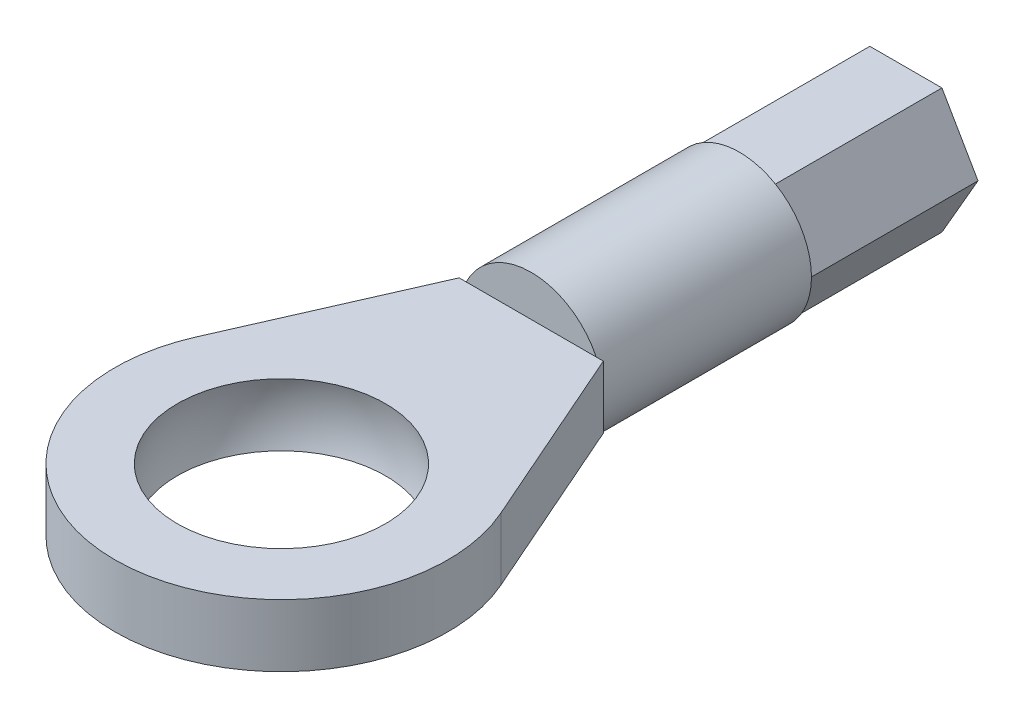
from build123d import *

# Parameters (mm, degrees)
SKETCH_1_R           = 1
EXTRUDE_1_DEPTH      = 4
EXTRUDE_START        = 4
SKETCH_2_R           = 1.732050808
EXTRUDE_2_DEPTH      = 5
EXTRUDE_3_DEPTH      = 0.75
EXTRUDE_3_DEPTH_BACK = 0.75
SKETCH_3_R           = 2.5


with BuildPart() as part:
    # 草图1 → 凸台-拉伸1 (new body)
    with BuildSketch(Plane.XY):
        Polygon((0.866025404, 1.5), (-0.866025404, 1.5), (-1.732050808, 0), (-0.866025404, -1.5), (0.866025404, -1.5), (1.732050808, 0), align=None)
        Circle(SKETCH_1_R, mode=Mode.SUBTRACT)
    extrude(amount=EXTRUDE_1_DEPTH)

    # 草图2 → 凸台-拉伸2 (add)
    with BuildSketch(Plane.XY.offset(EXTRUDE_START)):
        Circle(SKETCH_2_R)
    extrude(amount=EXTRUDE_2_DEPTH)

    # 草图3 → 凸台-拉伸3 (add, two sides: drawn at the far end of the back side and taken through both)
    with BuildSketch(Plane(origin=(0, 0, 0), x_dir=(1, 0, 0), z_dir=(0, 1, 0)).offset(-EXTRUDE_3_DEPTH_BACK)):
        with BuildLine():
            Line((-1.732050808, -9), (-3.661865884, -13.39042296))
            ThreePointArc((-3.661865884, -13.39042296), (0, -19), (3.661865884, -13.39042296))
            Line((3.661865884, -13.39042296), (1.732050808, -9))
            Line((1.732050808, -9), (-1.732050808, -9))
        make_face()
        with Locations(Location((0, -15, 0), (0, 0, 270))):
            Circle(SKETCH_3_R, mode=Mode.SUBTRACT)
    extrude(amount=EXTRUDE_3_DEPTH + EXTRUDE_3_DEPTH_BACK)

    # 草图4 → 切除-旋转2 (revolve, cut)
    with BuildSketch(Plane(origin=(0, 0, 0), x_dir=(0, 0, -1), z_dir=(1, 0, 0))):
        with BuildLine():
            Line((-15, -2.610076627), (-15, 2.610076627))
            ThreePointArc((-15, 2.610076627), (-17.610076627, 0), (-15, -2.610076627))
        make_face()
    revolve(axis=Axis((0, -2.610076627, 15), (0, 1, 0)), mode=Mode.SUBTRACT)


solid = part.part
